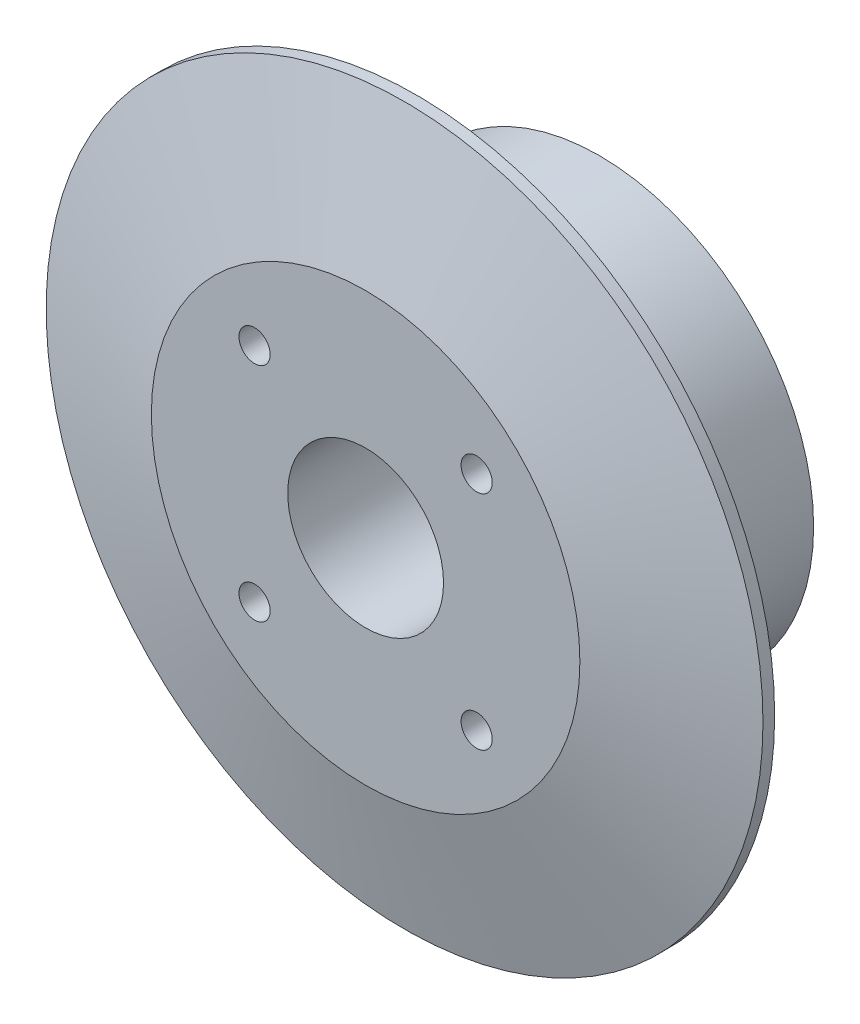
from build123d import *

# Parameters (mm, degrees)
SKETCH2_R          = 2
CUT_EXTRUDE1_DEPTH = 72.637978754


with BuildPart() as part:
    # Sketch1 → Revolve1 (revolve)
    with BuildSketch(Plane(origin=(0, 0, 0), x_dir=(0, 0, -1), z_dir=(1, 0, 0)), mode=Mode.PRIVATE) as revolve1_sk:
        Polygon((0, 10), (0, 27.5), (5, 46), (6.5, 46), (1.5, 27.5), (30, 27.5), (30, 10), align=None)
    revolve(revolve1_sk.sketch.rotate(Axis((0, 0, 467.574650711), (0, 0, -1)), 90), axis=Axis((0, 0, 467.574650711), (0, 0, -1)))

    # Sketch2 → Cut-Extrude1 (cut, through all)
    with BuildSketch(Plane.XY):
        with Locations((-14.25, 14.25)):
            Circle(SKETCH2_R)
        with Locations((14.25, 14.25)):
            Circle(SKETCH2_R)
        with Locations((14.25, -14.25)):
            Circle(SKETCH2_R)
        with Locations((-14.25, -14.25)):
            Circle(SKETCH2_R)
    extrude(amount=-CUT_EXTRUDE1_DEPTH, mode=Mode.SUBTRACT)


solid = part.part
